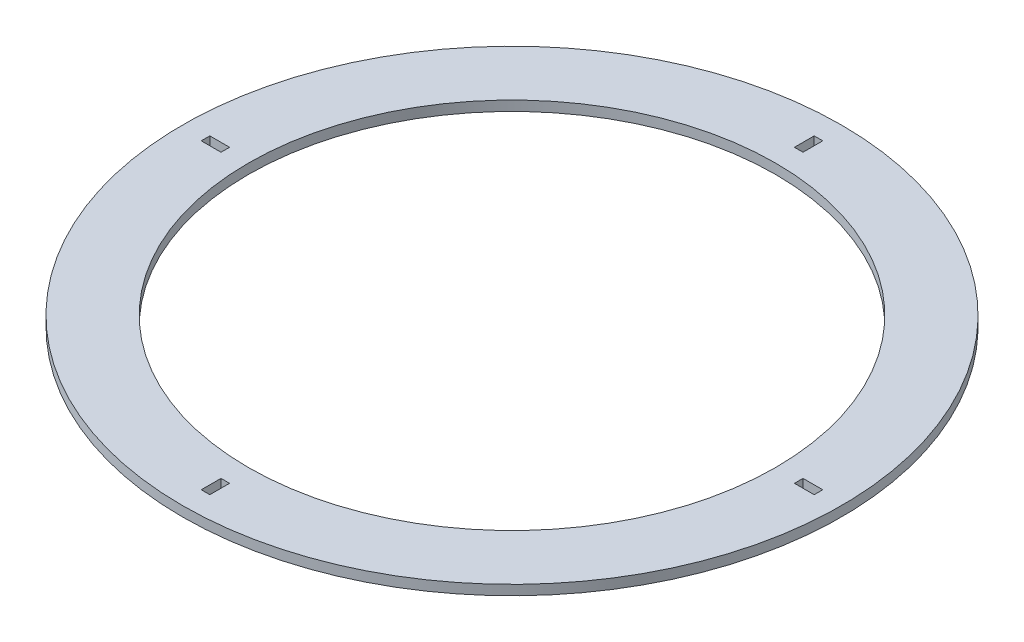
from build123d import *

# Parameters (mm, degrees)
SKETCH2_R           = 100
SKETCH2_R_2         = 80
BOSS_EXTRUDE1_DEPTH = 3
SKETCH3_W           = 2.6
SKETCH3_H           = 6
CUT_EXTRUDE1_DEPTH  = 142.453172464
CIRPATTERN1_COUNT   = 4


with BuildPart() as part:
    # Sketch2 → Boss-Extrude1 (new body)
    with BuildSketch(Plane(origin=(0, 0, 0), x_dir=(1, 0, 0), z_dir=(0, 1, 0))):
        with Locations(Location((0, 0, 0), (0, 0, 270))):
            Circle(SKETCH2_R)
        with Locations(Location((0, 0, 0), (0, 0, 270))):
            Circle(SKETCH2_R_2, mode=Mode.SUBTRACT)
    extrude(amount=BOSS_EXTRUDE1_DEPTH)

    # Sketch3 → Cut-Extrude1 (cut, through all)
    with BuildSketch(Plane(origin=(0, 3, 0), x_dir=(1, 0, 0), z_dir=(0, 1, 0))):
        with Locations((0, -90)):
            Rectangle(SKETCH3_W, SKETCH3_H)
    cut_extrude1 = extrude(amount=-CUT_EXTRUDE1_DEPTH, mode=Mode.SUBTRACT)

    # CirPattern1: Cut-Extrude1 ×4 about axis
    cirpattern1_axis = Axis((0, 0, 0), (0, 1, 0))
    for i in range(1, CIRPATTERN1_COUNT):
        add(cut_extrude1.rotate(cirpattern1_axis, i * 360 / CIRPATTERN1_COUNT), mode=Mode.SUBTRACT)


solid = part.part
